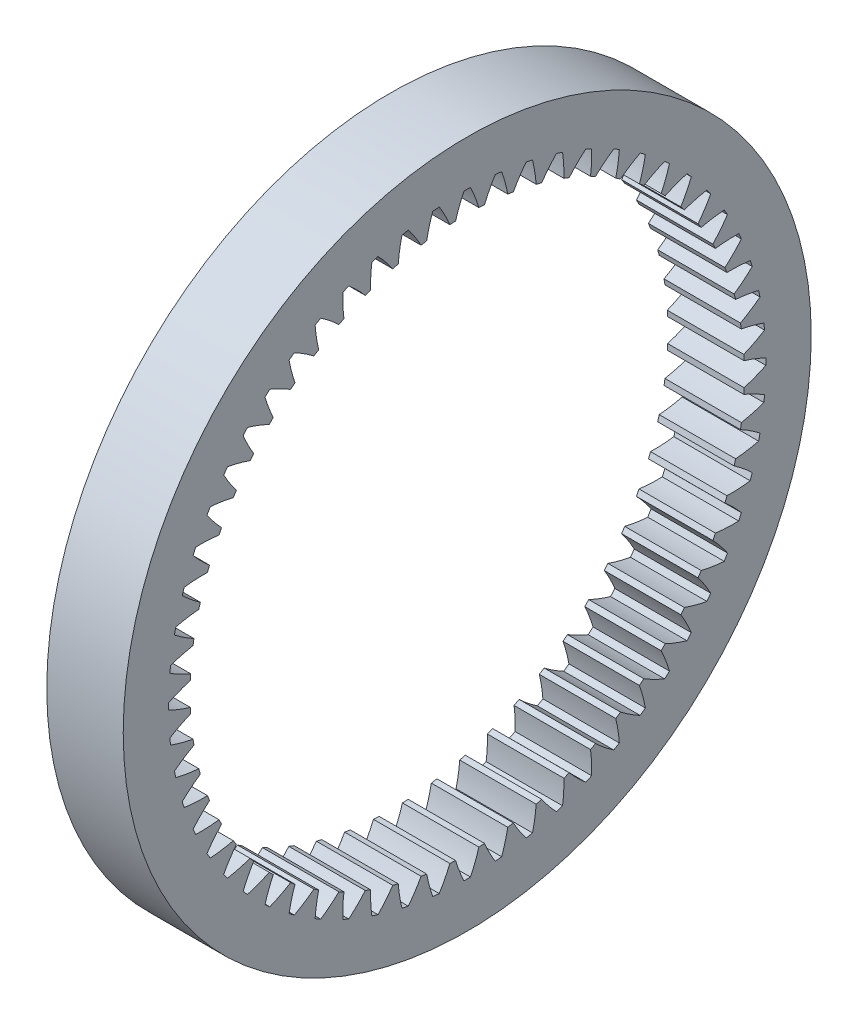
from build123d import *

# Parameters (mm, degrees)
BASPROSKE_W     = 4
BASPROSKE_H     = 3.5
TOOTHCUT_DEPTH  = 26.768197453
TEETHCUTS_COUNT = 60
TEETHCUTS_ANGLE = 354


with BuildPart() as part:
    # BasProSke → Base-Revolve (revolve)
    with BuildSketch(Plane(origin=(0, 0, 0), x_dir=(1, 0, 0), z_dir=(0, 1, 0)), mode=Mode.PRIVATE) as base_revolve_sk:
        with Locations((2, 16.25)):
            Rectangle(BASPROSKE_W, BASPROSKE_H)
    revolve(base_revolve_sk.sketch.rotate(Axis((-10, 0, 0), (1, 0, 0)), 180), axis=Axis((-10, 0, 0), (1, 0, 0)))

    # TooCutSke → ToothCut (cut, through all)
    with BuildSketch(Plane(origin=(0, 0, 0), x_dir=(0, 0, -1), z_dir=(1, 0, 0))):
        with BuildLine():
            ThreePointArc((0.61745169, 14.4614245), (0.417714459, 15.052577068), (0.16952843, 15.625080355))
            ThreePointArc((0.16952843, 15.625080355), (0, 15.626), (-0.16952843, 15.625080355))
            ThreePointArc((-0.16952843, 15.625080355), (-0.417714459, 15.052577068), (-0.61745169, 14.4614245))
            ThreePointArc((-0.61745169, 14.4614245), (0, 14.4746), (0.61745169, 14.4614245))
        make_face()
    toothcut = extrude(amount=TOOTHCUT_DEPTH, mode=Mode.SUBTRACT)

    # TeethCuts: ToothCut ×60 about axis
    teethcuts_axis = Axis((-10, 0, 0), (1, 0, 0))
    for i in range(1, TEETHCUTS_COUNT):
        add(toothcut.rotate(teethcuts_axis, i * TEETHCUTS_ANGLE / (TEETHCUTS_COUNT - 1)), mode=Mode.SUBTRACT)


solid = part.part
